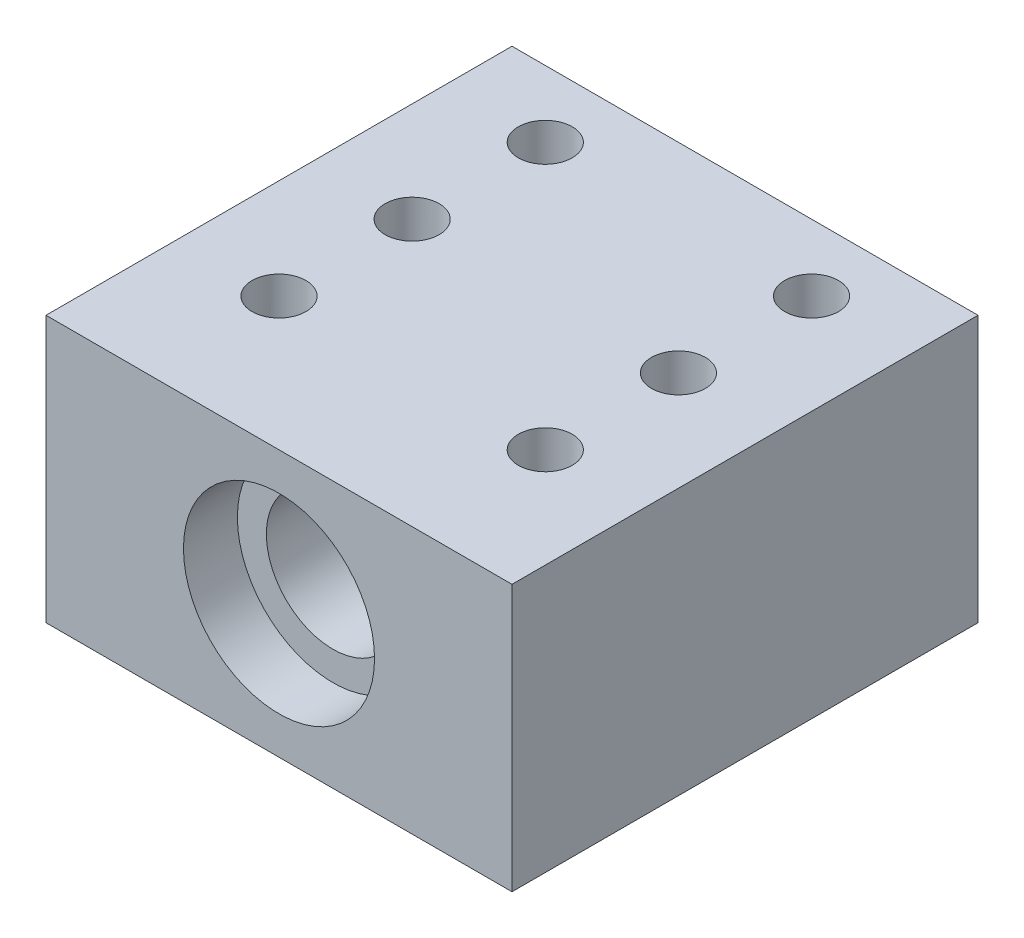
from build123d import *

# Parameters (mm, degrees)
BOSS_EXTRUDE1_DEPTH      = 40
BOSS_EXTRUDE1_DEPTH_BACK = 30
SKETCH1_W                = 70
SKETCH1_H                = 40
SKETCH1_R                = 10
CUT_EXTRUDE1_DEPTH       = 25
CUT_EXTRUDE1_DEPTH_BACK  = 25
SKETCH2_R                = 4.05
CUT_EXTRUDE2_START       = 40
SKETCH3_R                = 14.35
CUT_EXTRUDE2_DEPTH       = 8.1
CUT_EXTRUDE3_START       = -30
SKETCH4_R                = 14.2875
CUT_EXTRUDE3_DEPTH       = 8.1


with BuildPart() as part:
    # Sketch1 → Boss-Extrude1 (new, two sides: drawn at the far end of the back side and taken through both)
    with BuildSketch(Plane.XY.offset(-BOSS_EXTRUDE1_DEPTH_BACK)):
        Rectangle(SKETCH1_W, SKETCH1_H)
        Circle(SKETCH1_R, mode=Mode.SUBTRACT)
    extrude(amount=BOSS_EXTRUDE1_DEPTH + BOSS_EXTRUDE1_DEPTH_BACK)

    # Sketch2 → Cut-Extrude1 (cut, two sides: drawn at the far end of the back side and taken through both)
    with BuildSketch(Plane(origin=(0, 0, 0), x_dir=(1, 0, 0), z_dir=(0, 1, 0)).offset(-CUT_EXTRUDE1_DEPTH_BACK)):
        with Locations((-20, 20)):
            Circle(SKETCH2_R)
        with Locations((20, 20)):
            Circle(SKETCH2_R)
        with Locations((-20, -20)):
            Circle(SKETCH2_R)
        with Locations((20, -20)):
            Circle(SKETCH2_R)
        with Locations((-20, 0)):
            Circle(SKETCH2_R)
        with Locations((20, 0)):
            Circle(SKETCH2_R)
    extrude(amount=CUT_EXTRUDE1_DEPTH + CUT_EXTRUDE1_DEPTH_BACK, mode=Mode.SUBTRACT)

    # Sketch3 → Cut-Extrude2 (cut)
    with BuildSketch(Plane.XY.offset(CUT_EXTRUDE2_START)):
        Circle(SKETCH3_R)
    extrude(amount=-CUT_EXTRUDE2_DEPTH, mode=Mode.SUBTRACT)

    # Sketch4 → Cut-Extrude3 (cut)
    with BuildSketch(Plane.XY.offset(CUT_EXTRUDE3_START)):
        Circle(SKETCH4_R)
    extrude(amount=CUT_EXTRUDE3_DEPTH, mode=Mode.SUBTRACT)


solid = part.part
